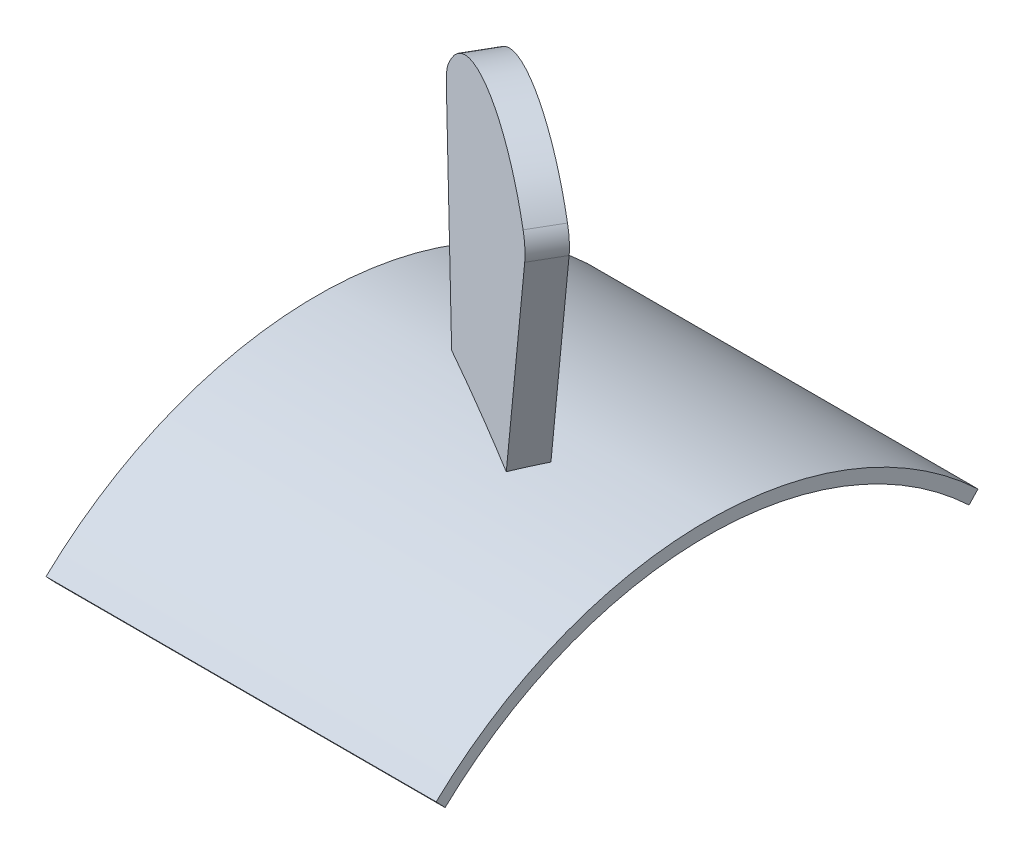
from build123d import *

# Parameters (mm, degrees)
EXTRUDE_THIN1_DEPTH = 76.2
EXTRUDE3_DEPTH      = 3.175


with BuildPart() as part:
    # Sketch1 → Extrude-Thin1 (new body)
    with BuildSketch(Plane(origin=(0, 0, 0), x_dir=(0, 0, -1), z_dir=(1, 0, 0))):
        with BuildLine():
            ThreePointArc((-40.374745946, 0), (12.536707256, 21.071210286), (65.448160458, 0))
            Line((65.448160458, 0), (63.702043982, -1.84463472))
            ThreePointArc((63.702043982, -1.84463472), (12.536707256, 18.531210286), (-38.628629469, -1.84463472))
            Line((-38.628629469, -1.84463472), (-40.374745946, 0))
        make_face()
    extrude(amount=-EXTRUDE_THIN1_DEPTH)

    # Sketch8 → Extrude3 (add, symmetric)
    with BuildSketch(Plane(origin=(-4.723115477, 0, 8.180675976), x_dir=(0.8660254037844382, 0, 0.500000000000001), z_dir=(-0.500000000000001, 0, 0.8660254037844382))):
        with BuildLine():
            Line((-26.019914049, 19.356414404), (-15.960161332, 62.469762483))
            ThreePointArc((-15.960161332, 62.469762483), (-15.889687792, 65.010575746), (-16.821324096, 67.375475819))
            ThreePointArc((-16.821324096, 67.375475819), (-36.428592093, 78.343903744), (-56.580491048, 68.411515413))
            ThreePointArc((-56.580491048, 68.411515413), (-57.544908965, 66.441876013), (-57.781782094, 64.261630063))
            Line((-57.781782094, 64.261630063), (-54.843835108, 19.356414404))
            Line((-54.843835108, 19.356414404), (-26.019914049, 19.356414404))
        make_face()
    extrude(amount=EXTRUDE3_DEPTH, both=True)


solid = part.part
